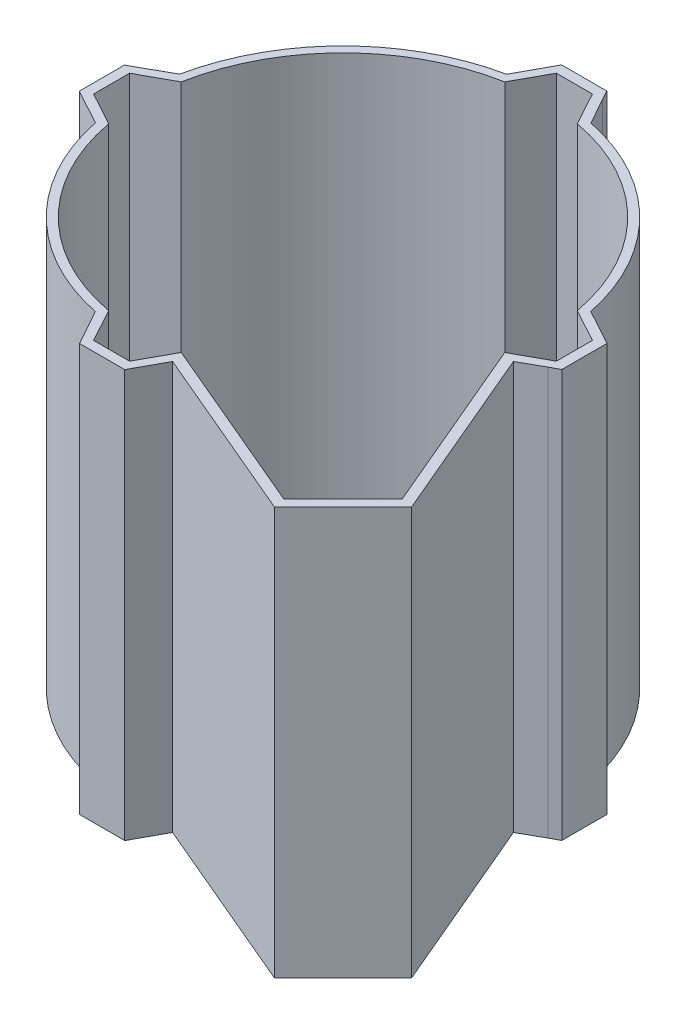
from build123d import *
from build123d.topology import SkipClean

# Parameters (mm, degrees)
SALIENTE_EXTRUIR1_DEPTH = 5
CROQUIS2_R              = 2.1
CORTAR_EXTRUIR1_DEPTH   = 83.176639016
CORTAR_EXTRUIR2_DEPTH   = 83.176639016
CROQUIS5_R              = 2.05
CORTAR_EXTRUIR4_DEPTH   = 83.176639016
SALIENTE_EXTRUIR2_DEPTH = 5
CORTAR_EXTRUIR10_DEPTH  = 98.128780493
SALIENTE_EXTRUIR4_DEPTH = 4
SALIENTE_EXTRUIR5_DEPTH = 4
CROQUIS17_R             = 2.4
CORTAR_EXTRUIR11_DEPTH  = 98.128780493
SALIENTE_EXTRUIR6_DEPTH = 104
CORTAR_EXTRUIR12_DEPTH  = 200


with BuildPart() as part:
    # Croquis1 → Saliente-Extruir1 (new body)
    with BuildSketch(Plane(origin=(0, 0, 0), x_dir=(1, 0, 0), z_dir=(0, 1, 0))):
        with BuildLine():
            Line((4, 58), (8.807070745, 49.218243619))
            ThreePointArc((8.807070745, 49.218243619), (35.355339059, 35.355339059), (49.218243619, 8.807070745))
            Line((49.218243619, 8.807070745), (58, 4))
            Line((58, 4), (58, -4))
            Line((58, -4), (49.218243619, -8.807070745))
            ThreePointArc((49.218243619, -8.807070745), (35.355339059, -35.355339059), (8.807070745, -49.218243619))
            Line((8.807070745, -49.218243619), (4, -58))
            Line((4, -58), (-4, -58))
            Line((-4, -58), (-8.807070745, -49.218243619))
            ThreePointArc((-8.807070745, -49.218243619), (-35.355339059, -35.355339059), (-49.218243619, -8.807070745))
            Line((-49.218243619, -8.807070745), (-58, -4))
            Line((-58, -4), (-58, 4))
            Line((-58, 4), (-49.218243619, 8.807070745))
            ThreePointArc((-49.218243619, 8.807070745), (-35.355339059, 35.355339059), (-8.807070745, 49.218243619))
            Line((-8.807070745, 49.218243619), (-4, 58))
            Line((-4, 58), (4, 58))
        make_face()
    extrude(amount=SALIENTE_EXTRUIR1_DEPTH)

    # Croquis2 → Cortar-Extruir1 (cut, through all)
    with BuildSketch(Plane(origin=(0, 5, 0), x_dir=(1, 0, 0), z_dir=(0, 1, 0))):
        with Locations(Location((0, 52.7, 0), (0, 0, 270))):
            Circle(CROQUIS2_R)
        with Locations(Location((52.7, 0, 0), (0, 0, 270))):
            Circle(CROQUIS2_R)
        with Locations(Location((0, -52.7, 0), (0, 0, 270))):
            Circle(CROQUIS2_R)
        with Locations(Location((-52.7, 0, 0), (0, 0, 270))):
            Circle(CROQUIS2_R)
    extrude(amount=-CORTAR_EXTRUIR1_DEPTH, mode=Mode.SUBTRACT)

    # Croquis3 → Cortar-Extruir2 (cut, through all)
    with BuildSketch(Plane(origin=(0, 5, 0), x_dir=(1, 0, 0), z_dir=(0, 1, 0))):
        Polygon((20.506096654, -34.648232278), (34.648232278, -20.506096654), (47.376154339, -33.234018716), (67.218949341, -53.076813717), (53.076813717, -67.218949341), (33.234018716, -47.376154339), align=None)
    extrude(amount=-CORTAR_EXTRUIR2_DEPTH, mode=Mode.SUBTRACT)

    # Croquis5 → Cortar-Extruir4 (cut, through all)
    with BuildSketch(Plane(origin=(0, 5, 0), x_dir=(1, 0, 0), z_dir=(0, 1, 0))):
        with Locations(Location((-7.78, 7.78, 0), (0, 0, 270))):
            Circle(CROQUIS5_R)
        with Locations(Location((7.78, 7.78, 0), (0, 0, 270))):
            Circle(CROQUIS5_R)
        with Locations(Location((7.78, -7.78, 0), (0, 0, 270))):
            Circle(CROQUIS5_R)
        with Locations(Location((-7.78, -7.78, 0), (0, 0, 270))):
            Circle(CROQUIS5_R)
        with BuildLine():
            Line((21.554064831, -30.039346205), (23.334523779, -31.819805153))
            Line((23.334523779, -31.819805153), (24.748737342, -30.405591591))
            Line((24.748737342, -30.405591591), (22.968278393, -28.625132642))
            ThreePointArc((22.968278393, -28.625132642), (19.622213178, -26.69328099), (21.554064831, -30.039346205))
        make_face()
        with BuildLine():
            Line((28.625132642, -22.968278393), (30.986174209, -25.329319959))
            Line((30.986174209, -25.329319959), (32.400387771, -23.915106397))
            Line((32.400387771, -23.915106397), (30.039346205, -21.554064831))
            ThreePointArc((30.039346205, -21.554064831), (26.69328099, -19.622213178), (28.625132642, -22.968278393))
        make_face()
    extrude(amount=-CORTAR_EXTRUIR4_DEPTH, mode=Mode.SUBTRACT)

    # Croquis7 → Saliente-Extruir2 (add, through all)
    with BuildSketch(Plane(origin=(0, 5, 0), x_dir=(1, 0, 0), z_dir=(0, 1, 0))):
        Polygon((68.589357775, -54.447222151), (54.447222151, -68.589357775), (8.807070745, -49.218243619), (18.571685103, -46.422973972), (27.56994834, -41.712083963), (48.790367902, -62.932503526), (62.932503526, -48.790367902), (41.712083963, -27.56994834), (46.422973972, -18.571685103), (49.218243619, -8.807070745), align=None)
    extrude(amount=-SALIENTE_EXTRUIR2_DEPTH)

    # Croquis8 → Cortar-Extruir10 (cut, through all)
    with BuildSketch(Plane(origin=(0, 5, 0), x_dir=(1, 0, 0), z_dir=(0, 1, 0))):
        with BuildLine():
            Line((54.283137452, -59.939991701), (51.490214314, -57.147068564))
            Line((51.490214314, -57.147068564), (50.076000752, -58.561282126))
            Line((50.076000752, -58.561282126), (52.868923889, -61.354205264))
            ThreePointArc((52.868923889, -61.354205264), (56.214989104, -63.286056916), (54.283137452, -59.939991701))
        make_face()
        with BuildLine():
            Line((57.371843354, -51.714989104), (58.786056916, -50.300775542))
            Line((58.786056916, -50.300775542), (61.354205264, -52.868923889))
            ThreePointArc((61.354205264, -52.868923889), (63.286056916, -56.214989104), (59.939991701, -54.283137452))
            Line((59.939991701, -54.283137452), (57.371843354, -51.714989104))
        make_face()
    extrude(amount=-CORTAR_EXTRUIR10_DEPTH, mode=Mode.SUBTRACT)

    # Croquis15 → Saliente-Extruir4 (add)
    with BuildSketch(Plane.XZ):
        with BuildLine():
            Line((-1.111111111, -20.469866441), (-1.111111111, -22.472548411))
            ThreePointArc((-1.111111111, -22.472548411), (0, 22.5), (1.111111111, -22.472548411))
            Line((1.111111111, -22.472548411), (1.111111111, -20.469866441))
            ThreePointArc((1.111111111, -20.469866441), (0, 20.5), (-1.111111111, -20.469866441))
        make_face()
    extrude(amount=SALIENTE_EXTRUIR4_DEPTH)

    # Croquis16 → Saliente-Extruir5 (add)
    with SkipClean():  # the faces are left unmerged after this step: merging them gives an invalid solid
        with BuildSketch(Plane.XZ):
            with BuildLine():
                Line((-1.111111111, -20.469866441), (-1.111111111, -22.472548411))
                ThreePointArc((-1.111111111, -22.472548411), (0, -22.5), (1.111111111, -22.472548411))
                Line((1.111111111, -22.472548411), (1.111111111, -20.469866441))
                ThreePointArc((1.111111111, -20.469866441), (0, -20.5), (-1.111111111, -20.469866441))
            make_face()
        extrude(amount=SALIENTE_EXTRUIR5_DEPTH)

    # Croquis17 → Cortar-Extruir11 (cut, through all)
    with SkipClean():  # the faces are left unmerged after this step: merging them gives an invalid solid
        with BuildSketch(Plane.XZ):
            with Locations(Location((42.43, 0, 0), (0, 0, 270))):
                Circle(CROQUIS17_R)
            with Locations(Location((0, -42.43, 0), (0, 0, 270))):
                Circle(CROQUIS17_R)
            with Locations(Location((-42.43, 0, 0), (0, 0, 270))):
                Circle(CROQUIS17_R)
            with Locations(Location((0, 42.43, 0), (0, 0, 270))):
                Circle(CROQUIS17_R)
        extrude(amount=-CORTAR_EXTRUIR11_DEPTH, mode=Mode.SUBTRACT)

    # Croquis18 → Saliente-Extruir6 (add)
    with SkipClean():  # the faces are left unmerged after this step: merging them gives an invalid solid
        with BuildSketch(Plane(origin=(0, 5, 0), x_dir=(1, 0, 0), z_dir=(0, 1, 0))):
            with BuildLine():
                Line((-7.026199157, 59.180786921), (-10.712769702, 52.416472271))
                ThreePointArc((-10.712769702, 52.416472271), (-37.80704006, 37.853371341), (-52.403312858, 10.776956969))
                Line((-52.403312858, 10.776956969), (-59.137075713, 7.002717611))
                Line((-59.137075713, 7.002717611), (-61.456288791, 5.738739948))
                Line((-61.456288791, 5.738739948), (-61.456288791, -5.78570304))
                Line((-61.456288791, -5.78570304), (-59.137075713, -7.049680703))
                Line((-59.137075713, -7.049680703), (-52.416550741, -10.71238575))
                ThreePointArc((-52.416550741, -10.71238575), (-37.841055246, -37.819367233), (-10.74243433, -52.41040073))
                Line((-10.74243433, -52.41040073), (-6.959006403, -59.160557259))
                Line((-6.959006403, -59.160557259), (-5.695028739, -61.479770337))
                Line((-5.695028739, -61.479770337), (5.829414249, -61.479770337))
                Line((5.829414249, -61.479770337), (7.093391912, -59.160557259))
                Line((7.093391912, -59.160557259), (10.133049539, -53.583232651))
                Line((10.133049539, -53.583232651), (55.252838681, -72.733488714))
                Line((55.252838681, -72.733488714), (72.733488714, -55.252838681))
                Line((72.733488714, -55.252838681), (53.583232651, -10.133049539))
                Line((53.583232651, -10.133049539), (59.204268467, -6.982487949))
                Line((59.204268467, -6.982487949), (61.523481546, -5.718510285))
                Line((61.523481546, -5.718510285), (61.523481546, 5.805932703))
                Line((61.523481546, 5.805932703), (59.204268467, 7.069910366))
                Line((59.204268467, 7.069910366), (52.403430197, 10.776386386))
                ThreePointArc((52.403430197, 10.776386386), (37.849997802, 37.810417433), (10.831208274, 52.392126578))
                Line((10.831208274, 52.392126578), (7.026199157, 59.180786921))
                Line((7.026199157, 59.180786921), (5.762221494, 61.5))
                Line((5.762221494, 61.5), (-5.762221494, 61.5))
                Line((-5.762221494, 61.5), (-7.026199157, 59.180786921))
            make_face()
        extrude(amount=SALIENTE_EXTRUIR6_DEPTH)

    # Croquis23 → Cortar-Extruir12 (cut)
    with BuildSketch(Plane.XZ.offset(4)):
        with BuildLine():
            Line((59, -4.59262422), (58.95889986, -4.615122143))
            Line((58.95889986, -4.615122143), (50.492416575, -9.249614646))
            ThreePointArc((50.492416575, -9.249614646), (36.297654901, -36.297654901), (9.249614646, -50.492416575))
            Line((9.249614646, -50.492416575), (4.615122143, -58.95889986))
            Line((4.615122143, -58.95889986), (4.592624221, -59))
            Line((4.592624221, -59), (-4.59262422, -59))
            Line((-4.59262422, -59), (-4.615122143, -58.95889986))
            Line((-4.615122143, -58.95889986), (-9.249614646, -50.492416575))
            ThreePointArc((-9.249614646, -50.492416575), (-36.297654901, -36.297654901), (-50.492416575, -9.249614646))
            Line((-50.492416575, -9.249614646), (-58.95889986, -4.615122143))
            Line((-58.95889986, -4.615122143), (-59, -4.592624221))
            Line((-59, -4.592624221), (-59, 4.59262422))
            Line((-59, 4.59262422), (-58.95889986, 4.615122143))
            Line((-58.95889986, 4.615122143), (-50.492416575, 9.249614646))
            ThreePointArc((-50.492416575, 9.249614646), (-36.297654901, 36.297654901), (-9.249614646, 50.492416575))
            Line((-9.249614646, 50.492416575), (-4.615122143, 58.95889986))
            Line((-4.615122143, 58.95889986), (-4.592624221, 59))
            Line((-4.592624221, 59), (4.59262422, 59))
            Line((4.59262422, 59), (4.615122143, 58.95889986))
            Line((4.615122143, 58.95889986), (9.249614646, 50.492416575))
            Line((9.249614646, 50.492416575), (54.677398303, 69.773395186))
            Line((54.677398303, 69.773395186), (69.773395186, 54.677398303))
            Line((69.773395186, 54.677398303), (50.492416575, 9.249614646))
            Line((50.492416575, 9.249614646), (58.95889986, 4.615122143))
            Line((58.95889986, 4.615122143), (59, 4.592624221))
            Line((59, 4.592624221), (59, -4.59262422))
        make_face()
    extrude(amount=-CORTAR_EXTRUIR12_DEPTH, mode=Mode.SUBTRACT)


solid = part.part
